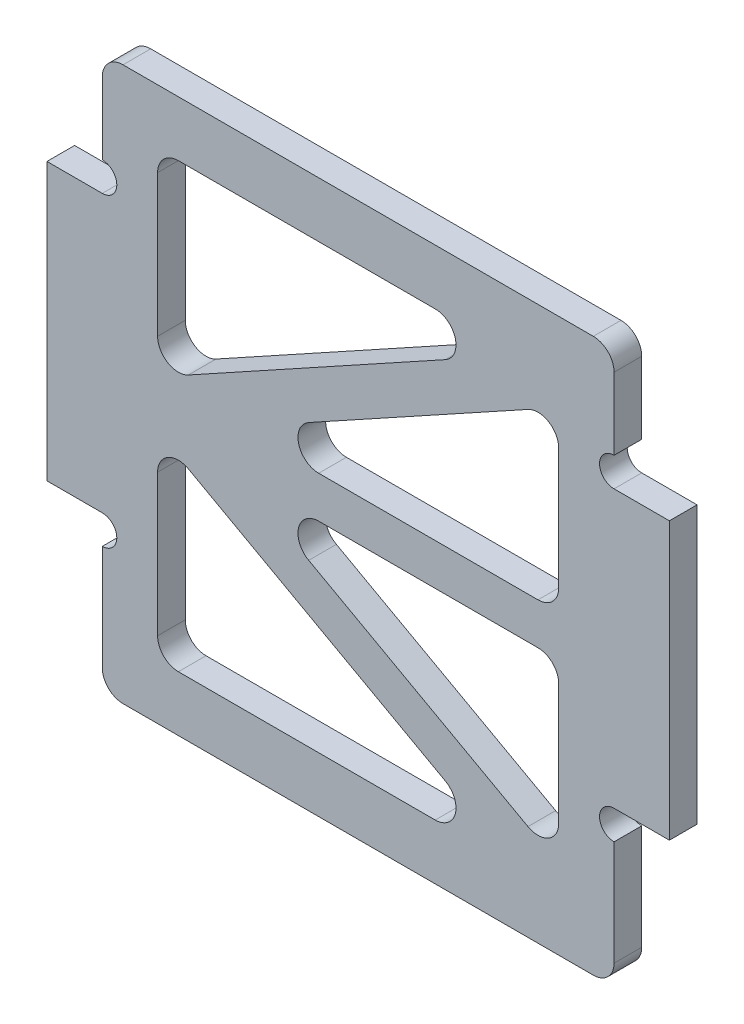
from build123d import *

# Parameters (mm, degrees)
SKETCH_1_W          = 37
SKETCH_1_H          = 40
EXTRUDE_1_DEPTH     = 2
SKETCH_2_W          = 2
SKETCH_2_H          = 20
EXTRUDE_2_DEPTH     = 4
SKETCH_3_R          = 1.05
CUT_EXTRUDE_1_DEPTH = 3
CUT_EXTRUDE_2_DEPTH = 10
FILLET_1_R          = 1.5


with BuildPart() as part:
    # 草图1 → 凸台-拉伸1 (new body)
    with BuildSketch(Plane.XY):
        Rectangle(SKETCH_1_W, SKETCH_1_H)
    extrude(amount=EXTRUDE_1_DEPTH)

    # 草图2 → 凸台-拉伸2 (add)
    with BuildSketch(Plane(origin=(18.5, 0, 0), x_dir=(0, 0, -1), z_dir=(1, 0, 0))):
        with Locations((-1, 1.2)):
            Rectangle(SKETCH_2_W, SKETCH_2_H)
    extrude_2 = extrude(amount=EXTRUDE_2_DEPTH)

    # 镜向1: 凸台-拉伸2 across plane
    add(extrude_2.mirror(Plane(origin=(0, 0, 0), x_dir=(0, 0, 1), z_dir=(1, 0, 0))))

    # 草图3 → 切除-拉伸1 (cut)
    with BuildSketch(Plane(origin=(0, 0, 0), x_dir=(-1, 0, 0), z_dir=(0, 0, -1))):
        with Locations((18.5, 12.25)):
            Circle(SKETCH_3_R)
        with Locations((18.5, -9.85)):
            Circle(SKETCH_3_R)
        with Locations((-18.5, -9.85)):
            Circle(SKETCH_3_R)
        with Locations((-18.5, 12.25)):
            Circle(SKETCH_3_R)
    extrude(amount=-CUT_EXTRUDE_1_DEPTH, mode=Mode.SUBTRACT)

    # 草图4 → 切除-拉伸2 (cut)
    with BuildSketch(Plane(origin=(0, 0, 0), x_dir=(-1, 0, 0), z_dir=(0, 0, -1))):
        Polygon((14.5, -1.713154672), (-11.394907157, -16), (14.5, -16), align=None)
        Polygon((-14.5, -1.5), (-14.5, -14.286845328), (8.676157157, -1.5), align=None)
        Polygon((-14.5, 14.286845328), (-14.5, 1.5), (8.676157157, 1.5), align=None)
        Polygon((-11.394907157, 16), (14.5, 1.713154672), (14.5, 16), align=None)
    extrude(amount=-CUT_EXTRUDE_2_DEPTH, mode=Mode.SUBTRACT)

    # 圆角1
    fillet_1_edges = [part.edges().sort_by_distance(p)[0] for p in [
        (11.394907157, 16, 1),
        (-14.5, 16, 1),
        (-14.5, 1.713154672, 1),
        (-14.5, -1.713154672, 1),
        (-14.5, -16, 1),
        (11.394907157, -16, 1),
        (18.5, -20, 1),
        (-18.5, -20, 1),
        (-18.5, 20, 1),
        (18.5, 20, 1),
        (14.5, -1.5, 1),
        (-8.676157157, -1.5, 1),
        (14.5, -14.286845328, 1),
        (14.5, 1.5, 1),
        (14.5, 14.286845328, 1),
        (-8.676157157, 1.5, 1),
    ]]
    fillet(fillet_1_edges, radius=FILLET_1_R)


solid = part.part
